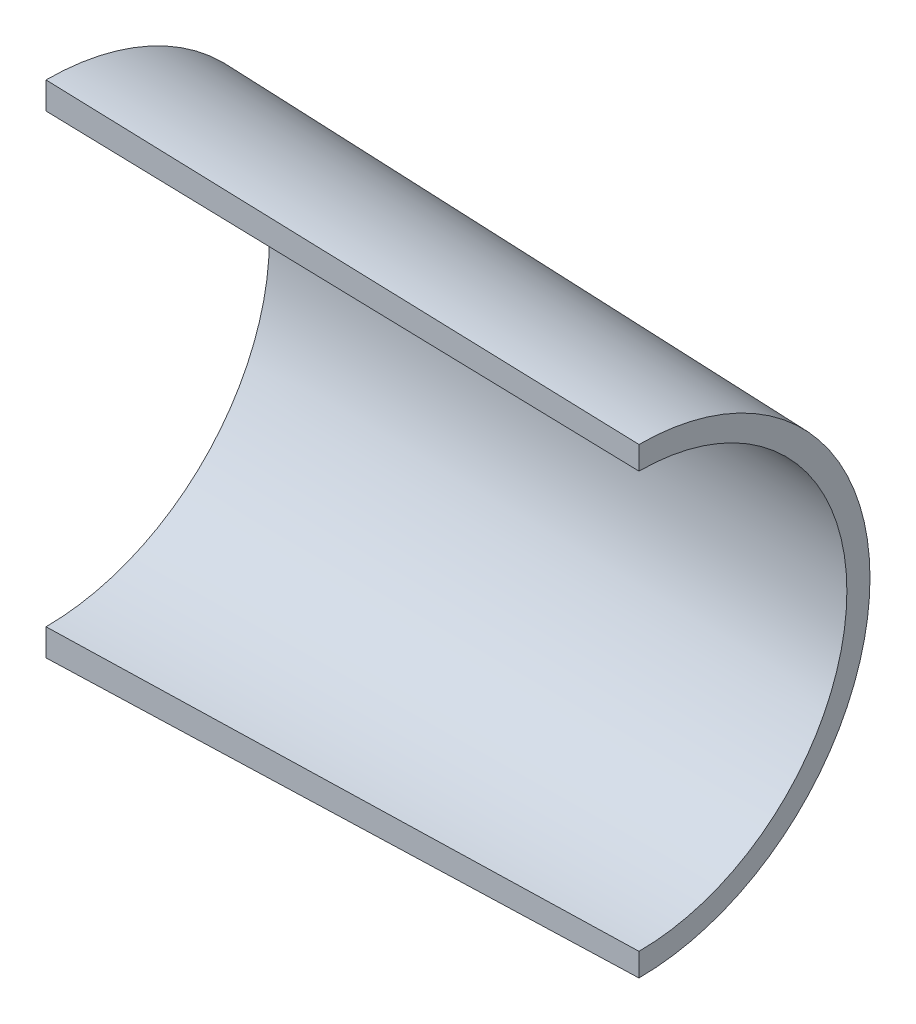
from build123d import *

# Parameters (mm, degrees)
REVOLVE1_ANGLE = 179.99999693


with BuildPart() as part:
    # Sketch1 → Revolve1 (revolve)
    with BuildSketch(Plane.XY):
        Polygon((1880, -580), (1880, -650), (3420, -600), (3420, -540), align=None)
    revolve(axis=Axis((0, 0, 0), (1, 0, 0)), revolution_arc=REVOLVE1_ANGLE)


solid = part.part
